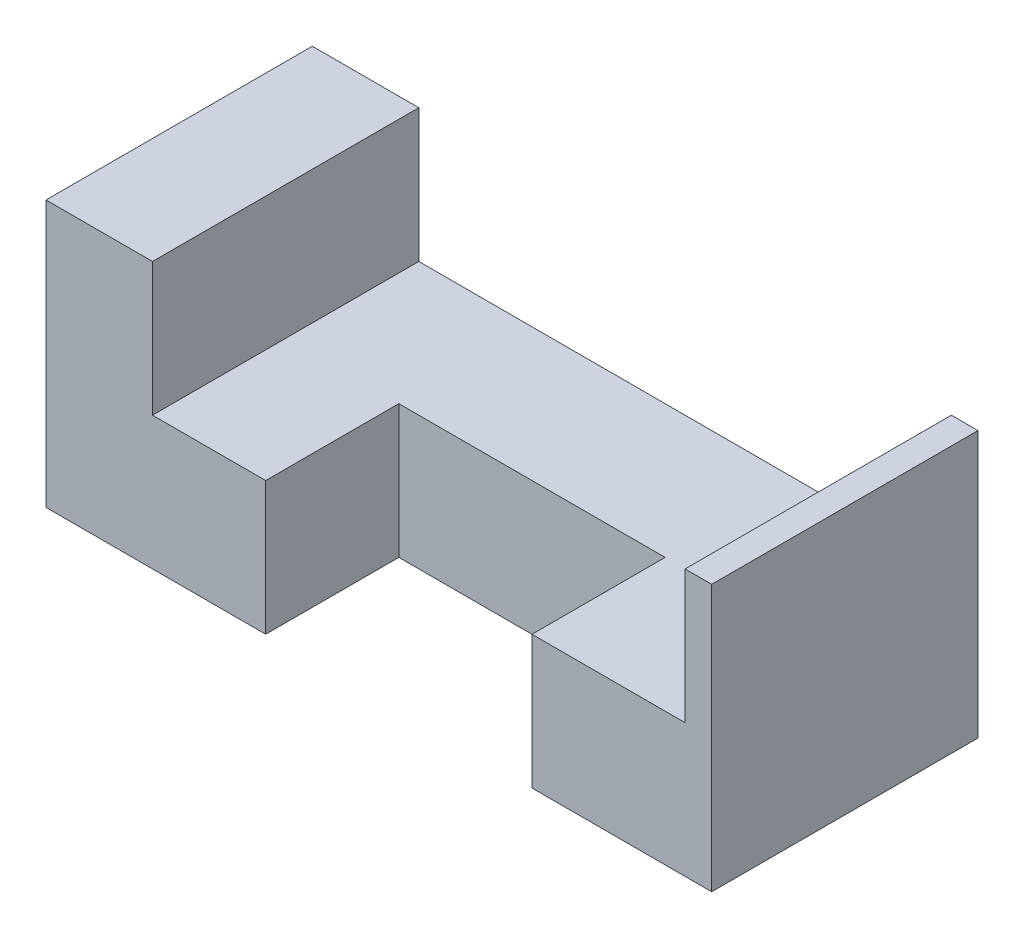
from build123d import *

# Parameters (mm, degrees)
EXTRUDE_1_DEPTH     = 20
SKETCH_2_W          = 20
SKETCH_2_H          = 10
CUT_EXTRUDE_1_DEPTH = 10


with BuildPart() as part:
    # 草圖1 → 填料-伸長1 (new body)
    with BuildSketch(Plane.XY):
        Polygon((-17, 10), (-25, 10), (-25, -10), (25, -10), (25, 10), (23, 10), (23, 0), (-17, 0), align=None)
    extrude(amount=EXTRUDE_1_DEPTH)

    # 草圖2 → 除料-伸長1 (cut)
    with BuildSketch(Plane(origin=(0, 0, 0), x_dir=(1, 0, 0), z_dir=(0, 1, 0))):
        with Locations((1.5, -15)):
            Rectangle(SKETCH_2_W, SKETCH_2_H)
    extrude(amount=-CUT_EXTRUDE_1_DEPTH, mode=Mode.SUBTRACT)


solid = part.part
